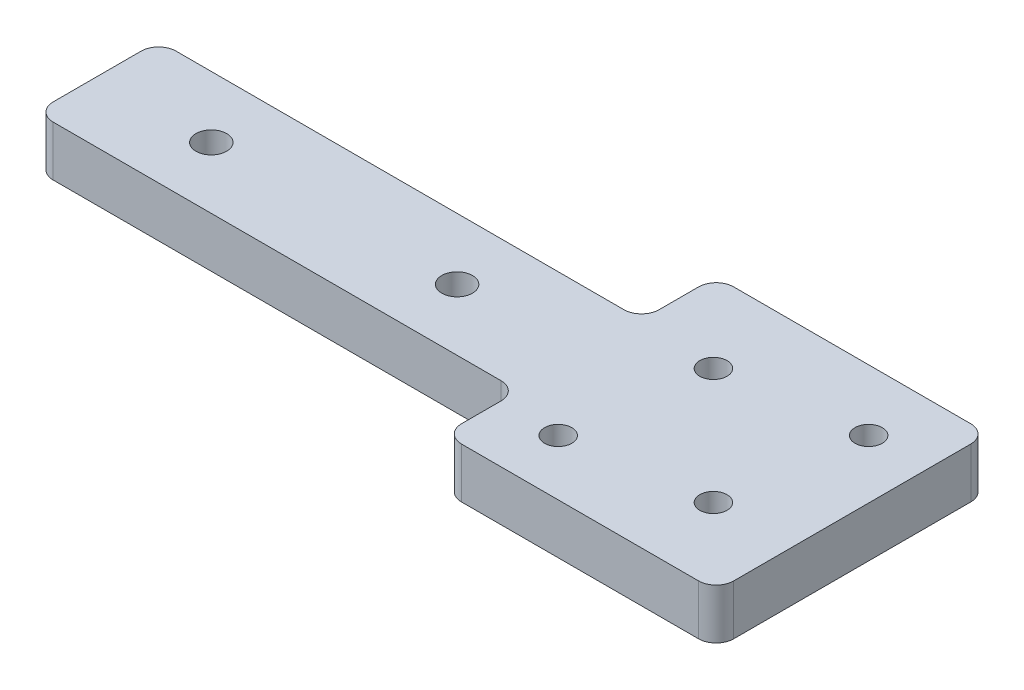
from build123d import *

# Parameters (mm, degrees)
SKETCH1_W           = 55
SKETCH1_H           = 14
BOSS_EXTRUDE1_DEPTH = 5.715
SKETCH2_R           = 1.75
CUT_EXTRUDE1_DEPTH  = 52.394687241
SKETCH3_W           = 31
SKETCH3_H           = 5.715
BOSS_EXTRUDE2_DEPTH = 31
SKETCH4_R           = 1.55
CUT_EXTRUDE2_DEPTH  = 84.264914302
FILLET1_R           = 2


with BuildPart() as part:
    # Sketch1 → Boss-Extrude1 (new body)
    with BuildSketch(Plane(origin=(0, 0, 0), x_dir=(1, 0, 0), z_dir=(0, 1, 0))):
        with Locations((23.05007671, 0.310430648)):
            Rectangle(SKETCH1_W, SKETCH1_H)
    extrude(amount=BOSS_EXTRUDE1_DEPTH)

    # Sketch2 → Cut-Extrude1 (cut, through all)
    with BuildSketch(Plane(origin=(0, 5.715, 0), x_dir=(1, 0, 0), z_dir=(0, 1, 0))):
        with Locations(Location((8.55007671, 0.310430648, 0), (0, 0, 270))):
            Circle(SKETCH2_R)
        with Locations(Location((36.55007671, 0.310430648, 0), (0, 0, 270))):
            Circle(SKETCH2_R)
    extrude(amount=-CUT_EXTRUDE1_DEPTH, mode=Mode.SUBTRACT)

    # Sketch3 → Boss-Extrude2 (add)
    with BuildSketch(Plane(origin=(50.55007671, 0, 0), x_dir=(0, 0, -1), z_dir=(1, 0, 0))):
        with Locations((0.310430648, 2.8575)):
            Rectangle(SKETCH3_W, SKETCH3_H)
    extrude(amount=BOSS_EXTRUDE2_DEPTH)

    # Sketch4 → Cut-Extrude2 (cut, through all)
    with BuildSketch(Plane(origin=(0, 5.715, 0), x_dir=(1, 0, 0), z_dir=(0, 1, 0))):
        with Locations(Location((57.211241945, -8.838834765, 0), (0, 0, 270))):
            Circle(SKETCH4_R)
        with Locations(Location((59.438628306, 6.611448404, 0), (0, 0, 270))):
            Circle(SKETCH4_R)
        with Locations(Location((74.888911475, 8.838834765, 0), (0, 0, 270))):
            Circle(SKETCH4_R)
        with Locations(Location((72.661525114, -6.611448404, 0), (0, 0, 270))):
            Circle(SKETCH4_R)
    extrude(amount=-CUT_EXTRUDE2_DEPTH, mode=Mode.SUBTRACT)

    # Fillet1
    fillet1_edges = [part.edges().sort_by_distance(p)[0] for p in [
        (-4.44992329, 2.8575, -7.310430648),
        (-4.44992329, 2.8575, 6.689569352),
        (50.55007671, 2.8575, -7.310430648),
        (50.55007671, 2.8575, 6.689569352),
        (50.55007671, 2.8575, -15.810430648),
        (81.55007671, 2.8575, -15.810430648),
        (81.55007671, 2.8575, 15.189569352),
        (50.55007671, 2.8575, 15.189569352),
    ]]
    fillet(fillet1_edges, radius=FILLET1_R)


solid = part.part
